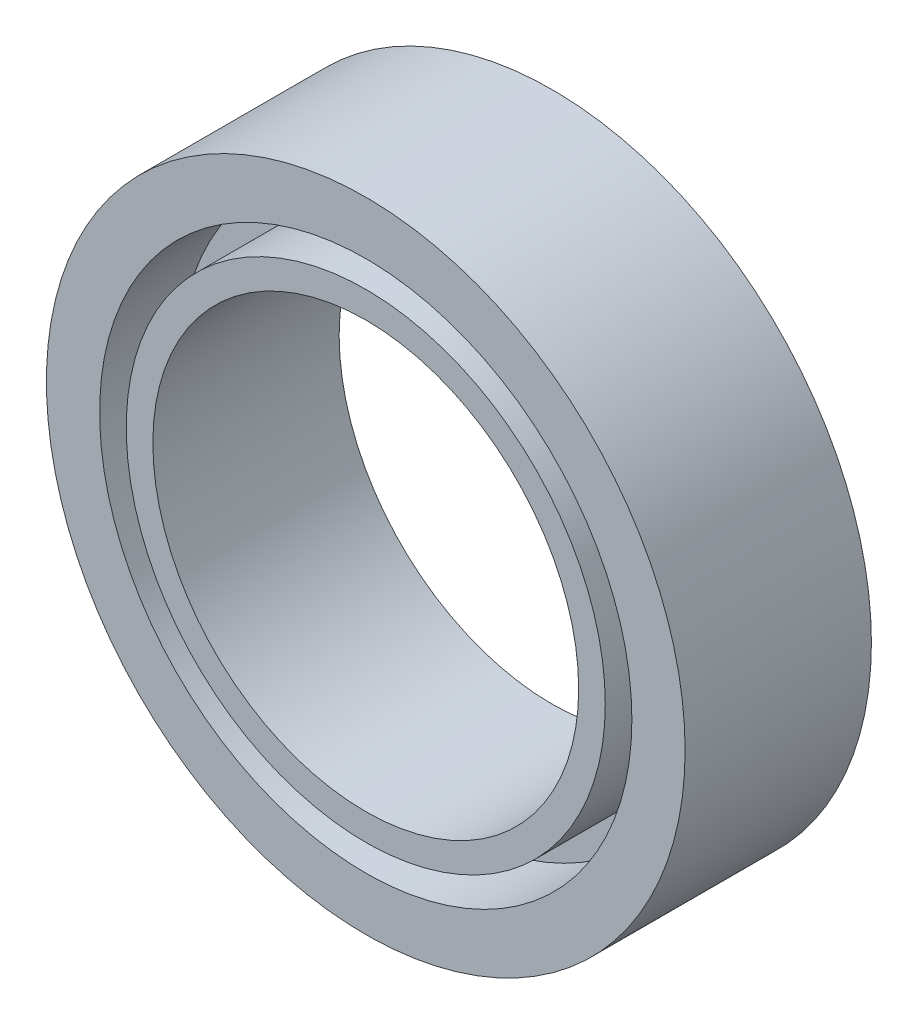
from build123d import *

# Parameters (mm, degrees)
SKETCH_1_R          = 6
SKETCH_1_R_2        = 4
EXTRUDE_1_DEPTH     = 3.5
SKETCH_2_R          = 5
SKETCH_2_R_2        = 4.5
CUT_EXTRUDE_1_DEPTH = 1.5


with BuildPart() as part:
    # 草图1 → 凸台-拉伸1 (new body)
    with BuildSketch(Plane.XY):
        Circle(SKETCH_1_R)
        Circle(SKETCH_1_R_2, mode=Mode.SUBTRACT)
    extrude(amount=EXTRUDE_1_DEPTH)

    # 草图2 → 切除-拉伸1 (cut)
    with BuildSketch(Plane.XY.offset(3.5)):
        Circle(SKETCH_2_R)
        Circle(SKETCH_2_R_2, mode=Mode.SUBTRACT)
    cut_extrude_1 = extrude(amount=-CUT_EXTRUDE_1_DEPTH, mode=Mode.SUBTRACT)

    # 镜向1: 切除-拉伸1 across plane
    add(cut_extrude_1.mirror(Plane.XY.offset(1.75)), mode=Mode.SUBTRACT)


solid = part.part
